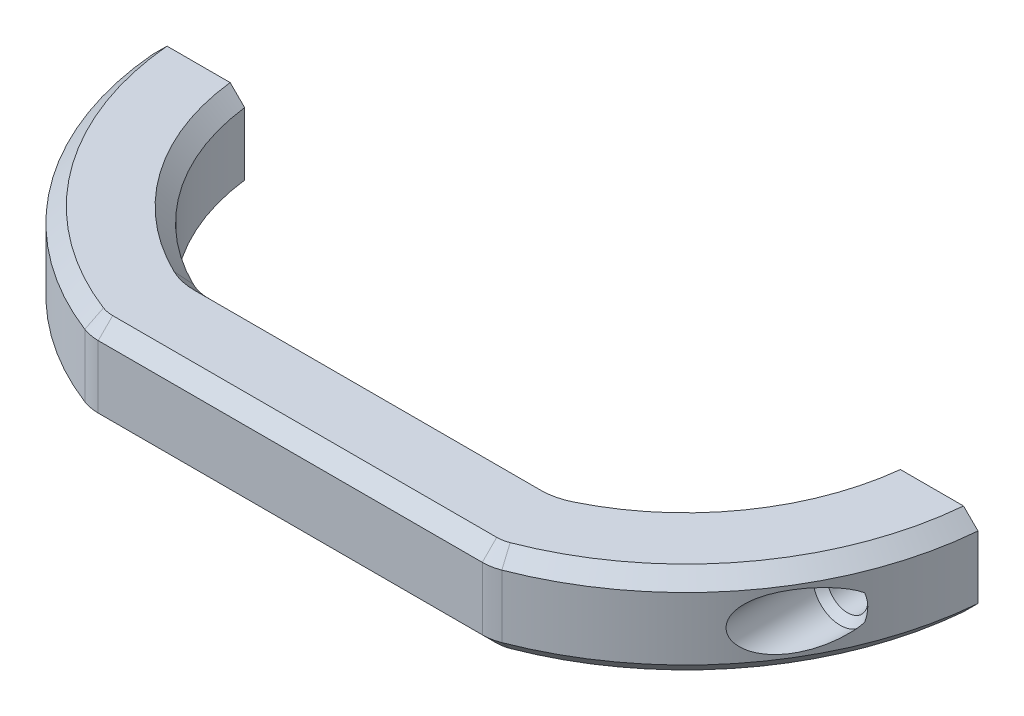
from build123d import *

# Parameters (mm, degrees)
BOSS_EXTRUDE1_DEPTH             = 6.35
FILLET1_R                       = 6.35
CHAMFER1_SIZE                   = 2
SKETCH3_R                       = 2.54
CUT_EXTRUDE1_DEPTH              = 63.891530963
F_10_CLEARANCE_HOLE1_AT_2_COUNT = 2
F_10_CLEARANCE_HOLE1_AT_2_PITCH = 101.605909567
SKETCH6_R                       = 3.81
CUT_EXTRUDE2_DEPTH              = 63.891531054


with BuildPart() as part:
    # Sketch2 → Boss-Extrude1 (new, symmetric)
    with BuildSketch(Plane(origin=(0, 0, 0), x_dir=(1, 0, 0), z_dir=(0, 1, 0))):
        with BuildLine():
            Line((-27.740386752, -38.1), (27.740386752, -38.1))
            ThreePointArc((27.740386752, -38.1), (48.067233392, -23.381874086), (57.182708636, 0))
            Line((57.182708636, 0), (44.417291364, 0))
            ThreePointArc((44.417291364, 0), (38.295246108, -15.252216058), (25.367291364, -25.4))
            Line((25.367291364, -25.4), (-25.367291364, -25.4))
            ThreePointArc((-25.367291364, -25.4), (-38.295246108, -15.252216058), (-44.417291364, 0))
            Line((-44.417291364, 0), (-57.182708636, 0))
            ThreePointArc((-57.182708636, 0), (-48.067233392, -23.381874086), (-27.740386752, -38.1))
        make_face()
    extrude(amount=BOSS_EXTRUDE1_DEPTH, both=True)

    # Fillet1
    fillet1_edges = [part.edges().sort_by_distance(p)[0] for p in [
        (-25.367291364, 0, 25.4),
        (25.367291364, 0, 25.4),
        (27.740386752, 0, 38.1),
        (-27.740386752, 0, 38.1),
    ]]
    fillet(fillet1_edges, radius=FILLET1_R)

    # Chamfer1
    chamfer1_edges = [part.edges().sort_by_distance(p)[0] for p in [
        (-48.438733528, -6.35, 22.894218644),
        (38.749073181, 6.35, 14.631598188),
        (-38.749073181, -6.35, 14.631598188),
        (-38.749073181, 6.35, 14.631598188),
        (0, -6.35, 25.4),
        (0, 6.35, 25.4),
        (48.438733528, -6.35, 22.894218644),
        (48.438733528, 6.35, 22.894218644),
        (0, -6.35, 38.1),
        (-27.76741166, -6.35, 37.992751984),
        (27.76741166, -6.35, 37.992751984),
        (0, 6.35, 38.1),
        (-27.76741166, 6.35, 37.992751984),
        (27.76741166, 6.35, 37.992751984),
        (-25.4153506, -6.35, 25.238431021),
        (-25.4153506, 6.35, 25.238431021),
        (25.4153506, -6.35, 25.238431021),
        (25.4153506, 6.35, 25.238431021),
        (-48.438733528, 6.35, 22.894218644),
        (38.749073181, -6.35, 14.631598188),
    ]]
    chamfer(chamfer1_edges, length=CHAMFER1_SIZE)

    # Sketch3 → Cut-Extrude1 (cut, through all)
    with BuildSketch(Plane.XY.offset(12.7)):
        with Locations(Location((50.802954783, 0, 0), (0, 0, 180))):
            Circle(SKETCH3_R)
        with Locations(Location((-50.802954783, 0, 0), (0, 0, 180))):
            Circle(SKETCH3_R)
    extrude(amount=CUT_EXTRUDE1_DEPTH, mode=Mode.SUBTRACT)

    # Sketch5 → #10 Clearance Hole1 (revolve, cut)
    with BuildSketch(Plane(origin=(50.802954783, 0, 12.7), x_dir=(0, -1, 0), z_dir=(1, 0, 0))):
        Polygon((0, 0), (0, 12.7), (2.8067, 12.7), (2.8067, 1.0033), (3.81, 0), align=None)
    f_10_clearance_hole1 = revolve(axis=Axis((50.802954783, 0, 19.05), (0, 0, -1)), mode=Mode.SUBTRACT)

    # #10 Clearance Hole1 at 2: #10 Clearance Hole1 ×2
    with Locations(*[(-i * F_10_CLEARANCE_HOLE1_AT_2_PITCH, 0, 0) for i in range(1, F_10_CLEARANCE_HOLE1_AT_2_COUNT)]):
        add(f_10_clearance_hole1, mode=Mode.SUBTRACT)

    # Sketch6 → Cut-Extrude2 (cut, through all)
    with BuildSketch(Plane.XY.offset(12.7)):
        with Locations((50.802954783, 0)):
            Circle(SKETCH6_R)
        with Locations((-50.802954783, 0)):
            Circle(SKETCH6_R)
    extrude(amount=CUT_EXTRUDE2_DEPTH, mode=Mode.SUBTRACT)


solid = part.part
